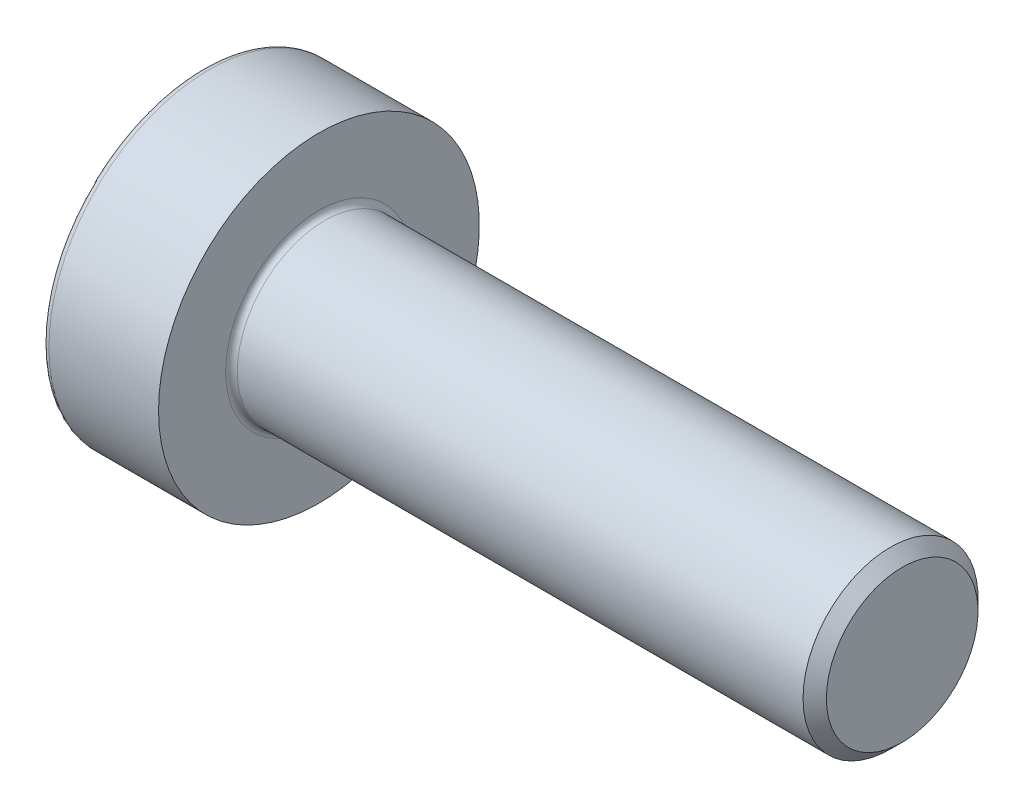
from build123d import *

# Parameters (mm, degrees)
FILLET1_R      = 0.1
FILLET2_R      = 0.12
CHAMFER1_SIZE  = 0.2
EXTRUDE1_DEPTH = 1


with BuildPart() as part:
    # Sketch1 → Revolve1 (revolve)
    with BuildSketch(Plane.XY, mode=Mode.PRIVATE) as revolve1_sk:
        Polygon((2, 1.5), (2, 0), (4.279914881, 0), (12, 0), (12, 1.5), align=None)
        Polygon((0, 2.75), (0, 0), (2, 0), (2, 1.5), (2, 2.75), align=None)
    revolve(revolve1_sk.sketch.rotate(Axis((0, 0, 0), (1, 0, 0)), 90), axis=Axis((0, 0, 0), (1, 0, 0)))

    # Fillet1
    fillet1_edges = [part.edges().sort_by_distance(p)[0] for p in [
        (2, 0, -1.5),
    ]]
    fillet(fillet1_edges, radius=FILLET1_R)

    # Fillet2
    fillet2_edges = [part.edges().sort_by_distance(p)[0] for p in [
        (0, 0, -2.75),
    ]]
    fillet(fillet2_edges, radius=FILLET2_R)

    # Chamfer1
    chamfer1_edges = [part.edges().sort_by_distance(p)[0] for p in [
        (12, 0, -1.5),
    ]]
    chamfer(chamfer1_edges, length=CHAMFER1_SIZE)

    # Sketch2 → Extrude1 (cut)
    with BuildSketch(Plane.ZY):
        Polygon((0, 1.443375673), (-1.25, 0.721687836), (-1.25, -0.721687836), (0, -1.443375673), (1.25, -0.721687836), (1.25, 0.721687836), align=None)
    extrude(amount=-EXTRUDE1_DEPTH, mode=Mode.SUBTRACT)


solid = part.part
